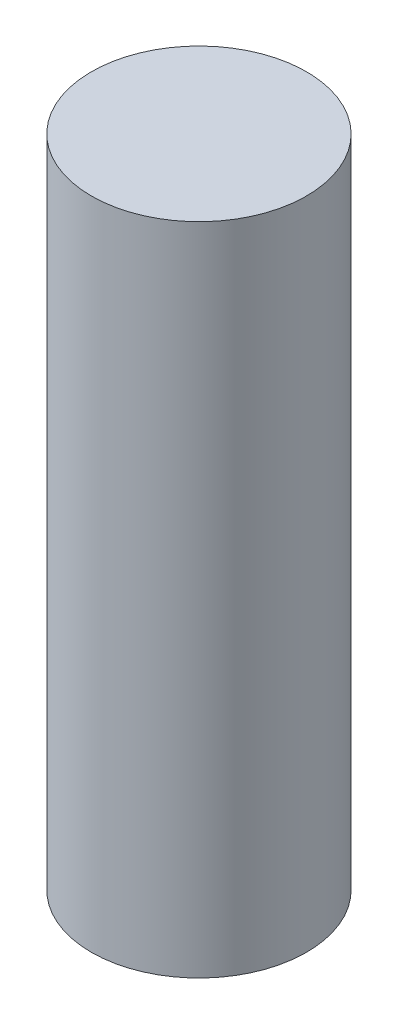
from build123d import *

# Parameters (mm, degrees)
SKETCH1_R           = 11.5
BOSS_EXTRUDE1_DEPTH = 70


with BuildPart() as part:
    # Sketch1 → Boss-Extrude1 (new body)
    with BuildSketch(Plane(origin=(0, 0, 0), x_dir=(1, 0, 0), z_dir=(0, 1, 0))):
        with Locations(Location((0, 0, 0), (0, 0, 270))):
            Circle(SKETCH1_R)
    extrude(amount=BOSS_EXTRUDE1_DEPTH)


solid = part.part
